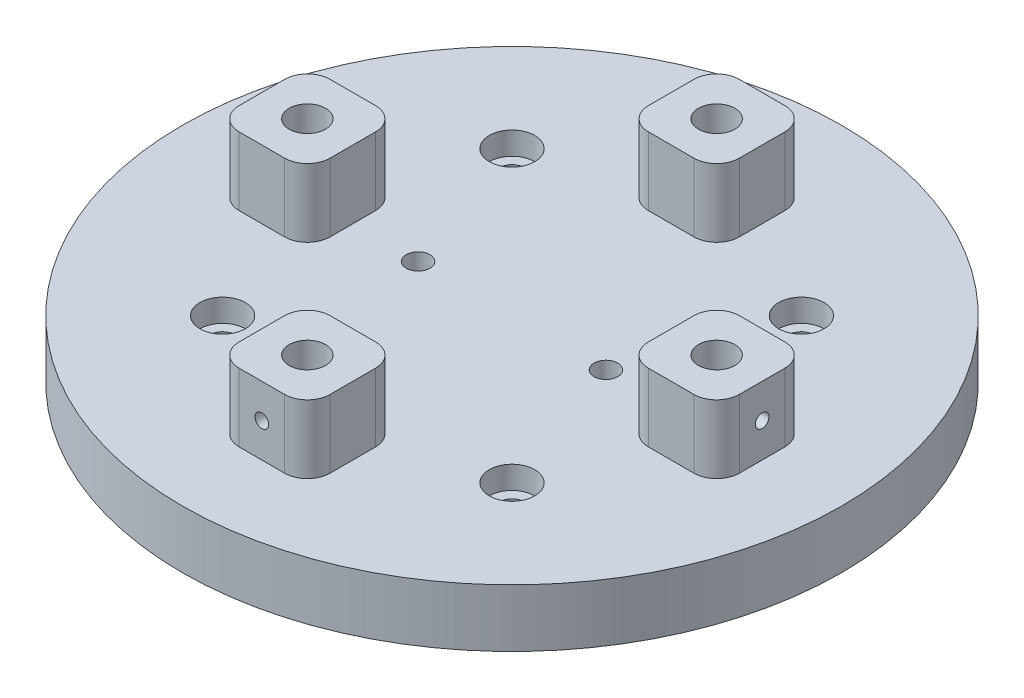
from build123d import *

# Parameters (mm, degrees)
SKETCH1_R                               = 72.5
BOSS_EXTRUDE1_DEPTH                     = 12.7
CBORE_FOR_M5_HEX_HEAD_BOLT2_D           = 5.5
CBORE_FOR_M5_HEX_HEAD_BOLT2_CBORE_D     = 10
CBORE_FOR_M5_HEX_HEAD_BOLT2_CBORE_DEPTH = 5
SKETCH22_R                              = 15
BOSS_EXTRUDE3_DEPTH                     = 38
SKETCH11_W                              = 20
SKETCH11_H                              = 20
BOSS_EXTRUDE2_DEPTH                     = 15
SKETCH24_R                              = 4
CUT_EXTRUDE7_DEPTH                      = 15
FILLET1_R                               = 5
CUT_EXTRUDE4_REACH                      = 153.514
CUT_EXTRUDE4_END_RADIUS                 = 4
SKETCH18_R                              = 1.5
CIRPATTERN2_COUNT                       = 4
FILLET1_OF_CIRPATTERN2_R                = 5
SKETCH25_R                              = 2.6
CUT_EXTRUDE8_DEPTH                      = 115.380898755
SKETCH26_R                              = 5
CUT_EXTRUDE9_DEPTH                      = 3.5


with BuildPart() as part:
    # Sketch1 → Boss-Extrude1 (new body)
    with BuildSketch(Plane(origin=(0, 0, 0), x_dir=(1, 0, 0), z_dir=(0, 1, 0))):
        with Locations(Location((0, 0, 0), (0, 0, 270))):
            Circle(SKETCH1_R)
    extrude(amount=BOSS_EXTRUDE1_DEPTH)

    # CBORE for M5 Hex Head Bolt2 (through all)
    with Locations(Plane(origin=(0, 12.7, 0), x_dir=(1, 0, 0), z_dir=(0, 1, 0))):
        with Locations((31.819805153, 31.819805153), (31.819805153, -31.819805153), (-31.819805153, -31.819805153), (-31.819805153, 31.819805153)):
            CounterBoreHole(CBORE_FOR_M5_HEX_HEAD_BOLT2_D / 2, CBORE_FOR_M5_HEX_HEAD_BOLT2_CBORE_D / 2, CBORE_FOR_M5_HEX_HEAD_BOLT2_CBORE_DEPTH)

    # Sketch22 → Boss-Extrude3 (add)
    with BuildSketch(Plane.XZ):
        with Locations(Location((0, 0, 0), (0, 0, 90))):
            Circle(SKETCH22_R)
    extrude(amount=BOSS_EXTRUDE3_DEPTH)

    # Sketch11 → Boss-Extrude2 (add)
    with BuildSketch(Plane(origin=(0, 12.7, 0), x_dir=(1, 0, 0), z_dir=(0, 1, 0))):
        with Locations((0, -45)):
            Rectangle(SKETCH11_W, SKETCH11_H)
    boss_extrude2 = extrude(amount=BOSS_EXTRUDE2_DEPTH)

    # Sketch24 → Cut-Extrude7 (cut)
    with BuildSketch(Plane(origin=(0, 27.7, 0), x_dir=(1, 0, 0), z_dir=(0, 1, 0))):
        with Locations(Location((0, -45, 0), (0, 0, 270))):
            Circle(SKETCH24_R)
    cut_extrude7 = extrude(amount=-CUT_EXTRUDE7_DEPTH, mode=Mode.SUBTRACT)

    # Fillet1
    fillet1_edges = [part.edges().sort_by_distance(p)[0] for p in [
        (10, 20.2, 55),
        (10, 20.2, 35),
        (-10, 20.2, 35),
        (-10, 20.2, 55),
    ]]
    fillet(fillet1_edges, radius=FILLET1_R)

    # Cut-Extrude4: up to this cylinder (the profile starts outside it)
    cut_extrude4_end = Plane(origin=(0, 20.2, 45), z_dir=(0, 1, 0)) * Cylinder(CUT_EXTRUDE4_END_RADIUS, 316.028, mode=Mode.PRIVATE)
    # Sketch18 → Cut-Extrude4 (cut, up to the surface)
    with BuildSketch(Plane.XY.offset(55), mode=Mode.PRIVATE) as cut_extrude4_sk1:
        with Locations((0, 20.2)):
            Circle(SKETCH18_R)
    cut_extrude4_tool1 = extrude(cut_extrude4_sk1.sketch, amount=-CUT_EXTRUDE4_REACH, mode=Mode.PRIVATE) - cut_extrude4_end
    cut_extrude4 = cut_extrude4_tool1.solids().sort_by_distance((0, 20.2, 55))[0]
    add(cut_extrude4, mode=Mode.SUBTRACT)

    # CirPattern2: Boss-Extrude2, Cut-Extrude7, Cut-Extrude4 ×4 about axis
    cirpattern2_axis = Axis((0, 0, 0), (0, 1, 0))
    add([boss_extrude2.rotate(cirpattern2_axis, i * 360 / CIRPATTERN2_COUNT) for i in range(1, CIRPATTERN2_COUNT)])
    add([cut_extrude7.rotate(cirpattern2_axis, i * 360 / CIRPATTERN2_COUNT) for i in range(1, CIRPATTERN2_COUNT)], mode=Mode.SUBTRACT)
    add([cut_extrude4.rotate(cirpattern2_axis, i * 360 / CIRPATTERN2_COUNT) for i in range(1, CIRPATTERN2_COUNT)], mode=Mode.SUBTRACT)

    # Fillet1 of CirPattern2
    fillet1_of_cirpattern2_edges = [part.edges().sort_by_distance(p)[0] for p in [
        (55, 20.2, -10),
        (35, 20.2, -10),
        (35, 20.2, 10),
        (55, 20.2, 10),
        (-10, 20.2, -55),
        (-10, 20.2, -35),
        (10, 20.2, -35),
        (10, 20.2, -55),
        (-55, 20.2, 10),
        (-35, 20.2, 10),
        (-35, 20.2, -10),
        (-55, 20.2, -10),
    ]]
    fillet(fillet1_of_cirpattern2_edges, radius=FILLET1_OF_CIRPATTERN2_R)

    # Sketch25 → Cut-Extrude8 (cut, through all)
    with BuildSketch(Plane(origin=(0, 12.7, 0), x_dir=(1, 0, 0), z_dir=(0, 1, 0))):
        with Locations(Location((20.65, 0, 0), (0, 0, 270))):
            Circle(SKETCH25_R)
        with Locations(Location((-20.65, 0, 0), (0, 0, 270))):
            Circle(SKETCH25_R)
    extrude(amount=-CUT_EXTRUDE8_DEPTH, mode=Mode.SUBTRACT)

    # Sketch26 → Cut-Extrude9 (cut)
    with BuildSketch(Plane.XZ):
        with Locations(Location((20.65, 0, 0), (0, 0, 270))):
            Circle(SKETCH26_R)
        with Locations(Location((-20.65, 0, 0), (0, 0, 90))):
            Circle(SKETCH26_R)
    extrude(amount=-CUT_EXTRUDE9_DEPTH, mode=Mode.SUBTRACT)


solid = part.part
